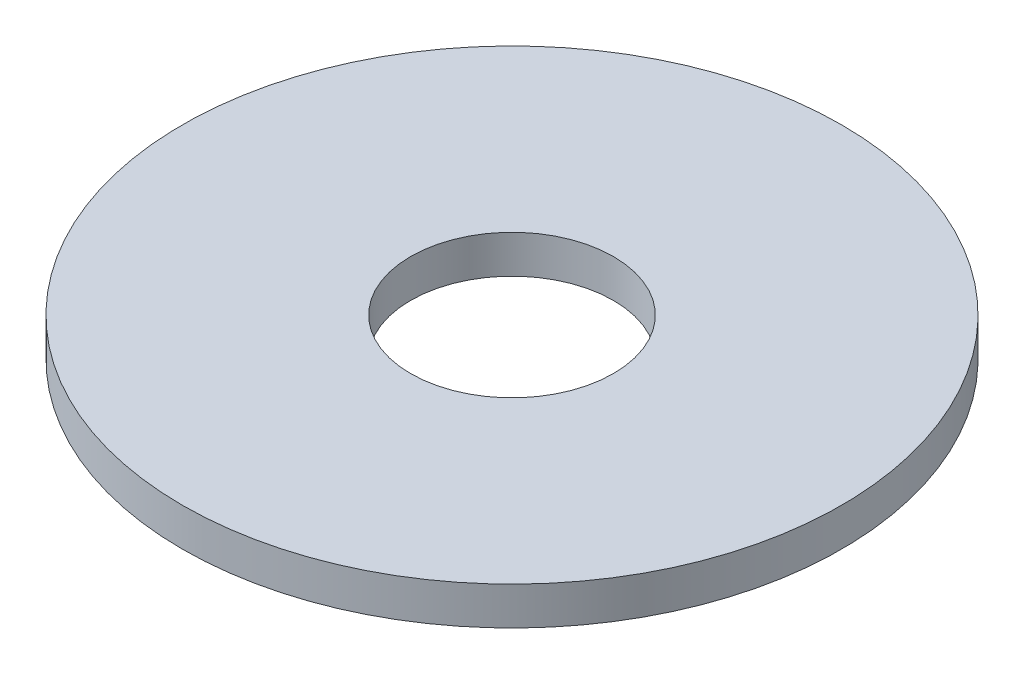
from build123d import *

# Parameters (mm, degrees)
SKETCH1_R           = 13
SKETCH1_R_2         = 4
BOSS_EXTRUDE1_DEPTH = 1.5


with BuildPart() as part:
    # Sketch1 → Boss-Extrude1 (new body)
    with BuildSketch(Plane(origin=(0, 0, 0), x_dir=(1, 0, 0), z_dir=(0, 1, 0))):
        with Locations(Location((0, 0, 0), (0, 0, 270))):
            Circle(SKETCH1_R)
        with Locations(Location((0, 0, 0), (0, 0, 270))):
            Circle(SKETCH1_R_2, mode=Mode.SUBTRACT)
    extrude(amount=BOSS_EXTRUDE1_DEPTH)


solid = part.part
